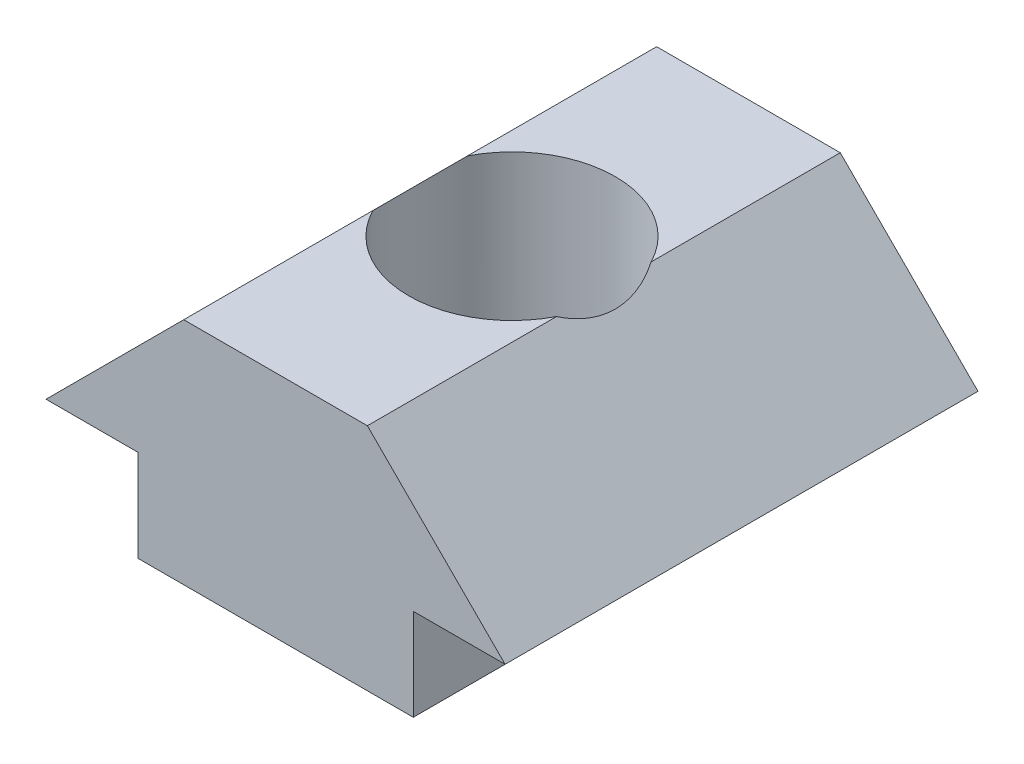
from build123d import *

# Parameters (mm, degrees)
BOSS_EXTRU_1_DEPTH = 10.3
D_GAGEMENT_M41_D   = 4.5


with BuildPart() as part:
    # Esquisse1 → Boss.-Extru.1 (new body)
    with BuildSketch(Plane.XY):
        Polygon((0, 0), (0, 2), (2, 2), (-1, 5), (-5, 5), (-8, 2), (-6, 2), (-6, 0), align=None)
    extrude(amount=BOSS_EXTRU_1_DEPTH)

    # Dégagement M41 (through all)
    with Locations(Plane(origin=(0, 5, 0), x_dir=(1, 0, 0), z_dir=(0, 1, 0))):
        with Locations((-3, -5.15)):
            Hole(D_GAGEMENT_M41_D / 2)


solid = part.part
